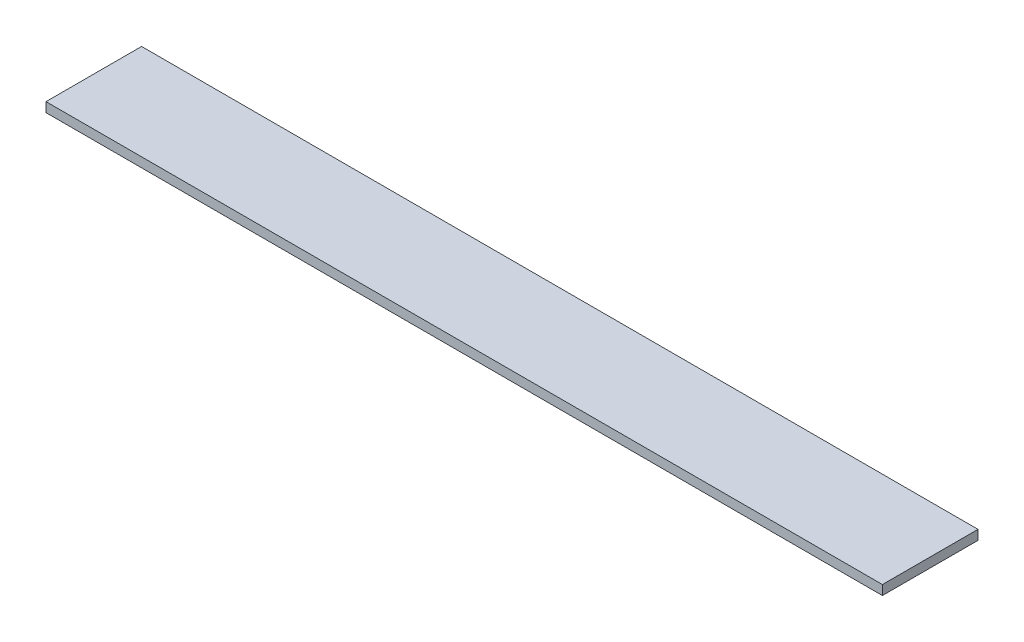
from build123d import *

# Parameters (mm, degrees)
SKETCH_1_W      = 350
SKETCH_1_H      = 40
EXTRUDE_1_DEPTH = 4


with BuildPart() as part:
    # Эскиз1 → Бобышка-Вытянуть1 (new body)
    with BuildSketch(Plane(origin=(0, 0, 0), x_dir=(1, 0, 0), z_dir=(0, 1, 0))):
        with Locations((175, 20)):
            Rectangle(SKETCH_1_W, SKETCH_1_H)
    extrude(amount=EXTRUDE_1_DEPTH)


solid = part.part
